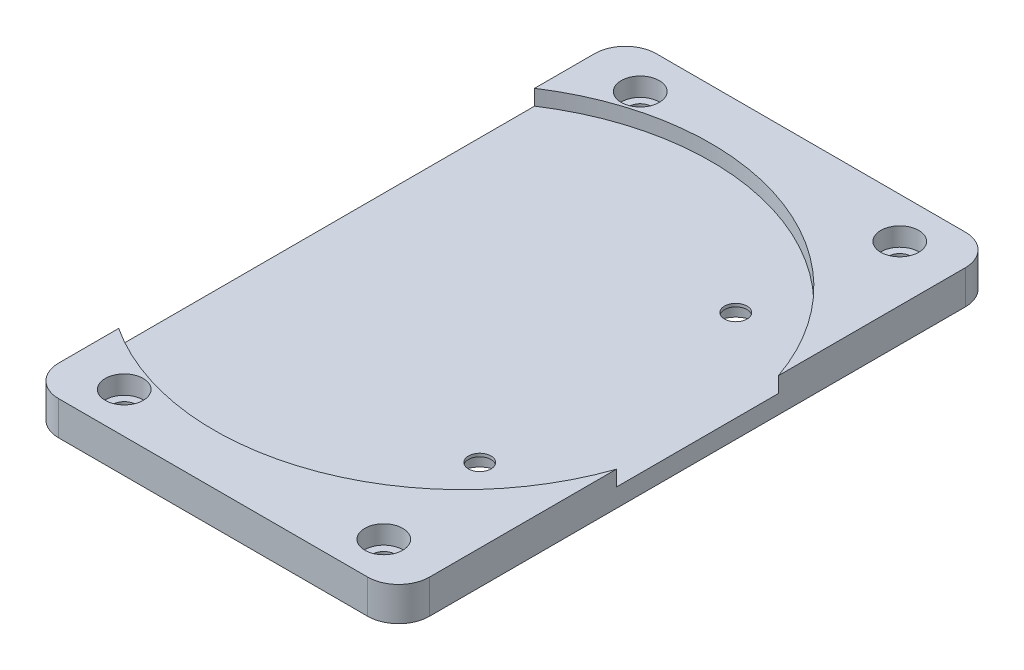
from build123d import *

# Parameters (mm, degrees)
CROQUIS2_W              = 60
CROQUIS2_H              = 96.7
CROQUIS2_R              = 1.825
SALIENTE_EXTRUIR1_DEPTH = 5.5
REDONDEO2_R             = 5
CROQUIS4_R              = 39.5
CORTAR_EXTRUIR1_DEPTH   = 2.5
CROQUIS5_R              = 1.825
CORTAR_EXTRUIR2_DEPTH   = 114.841512639
CROQUIS6_R              = 3.325
CORTAR_EXTRUIR3_DEPTH   = 2.5
CROQUIS7_R              = 3.075
CORTAR_EXTRUIR4_DEPTH   = 3
CROQUIS10_R             = 40.2
CORTAR_EXTRUIR5_DEPTH   = 2.5


with BuildPart() as part:
    # Croquis2 → Saliente-Extruir1 (new body)
    with BuildSketch(Plane(origin=(0, 0, 0), x_dir=(1, 0, 0), z_dir=(0, 1, 0))):
        with Locations((30, 48.35)):
            Rectangle(CROQUIS2_W, CROQUIS2_H)
        with Locations(Location((9, 6.6, 0), (0, 0, 270))):
            Circle(CROQUIS2_R, mode=Mode.SUBTRACT)
        with Locations(Location((51, 6.6, 0), (0, 0, 270))):
            Circle(CROQUIS2_R, mode=Mode.SUBTRACT)
        with Locations(Location((9, 90.1, 0), (0, 0, 90))):
            Circle(CROQUIS2_R, mode=Mode.SUBTRACT)
        with Locations(Location((51, 90.1, 0), (0, 0, 90))):
            Circle(CROQUIS2_R, mode=Mode.SUBTRACT)
    extrude(amount=SALIENTE_EXTRUIR1_DEPTH)

    # Redondeo2
    redondeo2_edges = [part.edges().sort_by_distance(p)[0] for p in [
        (0, 2.75, -96.7),
        (60, 2.75, -96.7),
        (60, 2.75, 0),
        (0, 2.75, 0),
    ]]
    fillet(redondeo2_edges, radius=REDONDEO2_R)

    # Croquis4 → Cortar-Extruir1 (cut)
    with BuildSketch(Plane(origin=(0, 5.5, 0), x_dir=(1, 0, 0), z_dir=(0, 1, 0))):
        with Locations((22, 48.35)):
            Circle(CROQUIS4_R)
    extrude(amount=-CORTAR_EXTRUIR1_DEPTH, mode=Mode.SUBTRACT)

    # Croquis5 → Cortar-Extruir2 (cut, through all)
    with BuildSketch(Plane(origin=(0, 3, 0), x_dir=(1, 0, 0), z_dir=(0, 1, 0))):
        with Locations(Location((45.211409163, 69.352226887, 0), (0, 0, 270))):
            Circle(CROQUIS5_R)
        with Locations(Location((45.497544097, 27.633908047, 0), (0, 0, 270))):
            Circle(CROQUIS5_R)
    extrude(amount=-CORTAR_EXTRUIR2_DEPTH, mode=Mode.SUBTRACT)

    # Croquis6 → Cortar-Extruir3 (cut)
    with BuildSketch(Plane.XZ):
        with Locations(Location((45.497544097, -27.633908047, 0), (0, 0, 270))):
            Circle(CROQUIS6_R)
        with Locations(Location((45.211409163, -69.352226887, 0), (0, 0, 270))):
            Circle(CROQUIS6_R)
    extrude(amount=-CORTAR_EXTRUIR3_DEPTH, mode=Mode.SUBTRACT)

    # Croquis7 → Cortar-Extruir4 (cut)
    with BuildSketch(Plane(origin=(0, 5.5, 0), x_dir=(1, 0, 0), z_dir=(0, 1, 0))):
        with Locations(Location((51, 90.1, 0), (0, 0, 270))):
            Circle(CROQUIS7_R)
        with Locations(Location((9, 90.1, 0), (0, 0, 90))):
            Circle(CROQUIS7_R)
        with Locations(Location((51, 6.6, 0), (0, 0, 90))):
            Circle(CROQUIS7_R)
        with Locations(Location((9, 6.6, 0), (0, 0, 270))):
            Circle(CROQUIS7_R)
    extrude(amount=-CORTAR_EXTRUIR4_DEPTH, mode=Mode.SUBTRACT)

    # Croquis10 → Cortar-Extruir5 (cut)
    with BuildSketch(Plane(origin=(0, 5.5, 0), x_dir=(1, 0, 0), z_dir=(0, 1, 0))):
        with Locations((22, 48.35)):
            Circle(CROQUIS10_R)
    extrude(amount=-CORTAR_EXTRUIR5_DEPTH, mode=Mode.SUBTRACT)


solid = part.part
